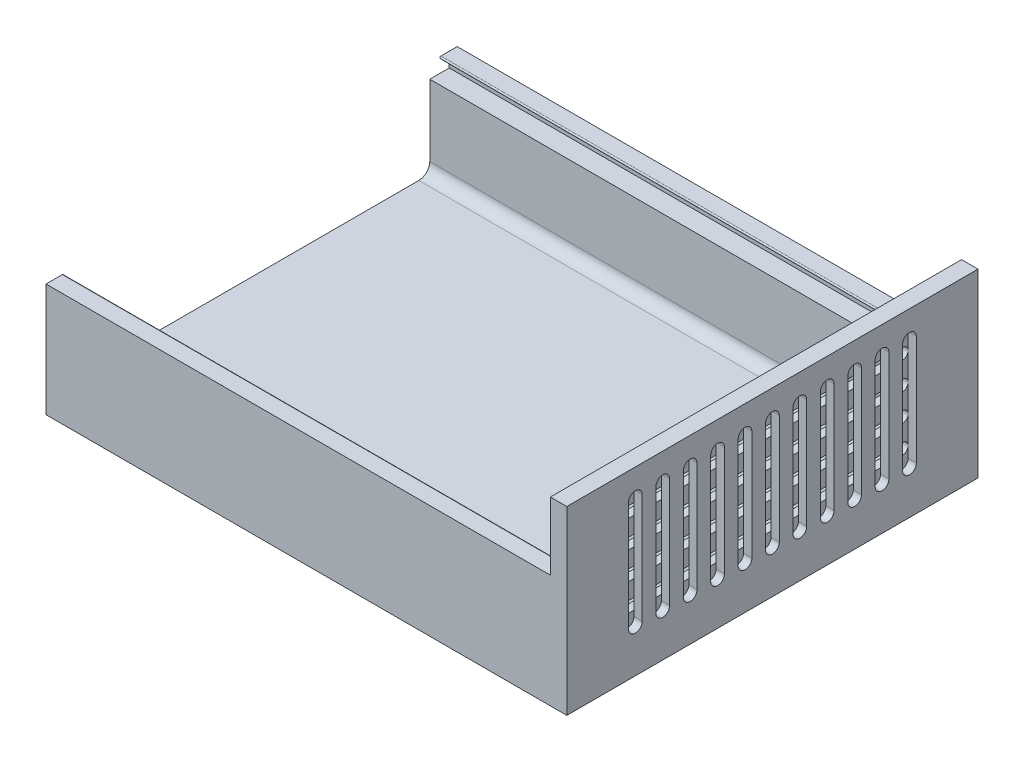
from build123d import *

# Parameters (mm, degrees)
SKETCH1_W           = 95
SKETCH1_H           = 75
BOSS_EXTRUDE1_DEPTH = 3
SKETCH2_W           = 95
SKETCH2_H           = 5
BOSS_EXTRUDE2_DEPTH = 15
SKETCH3_W           = 3
SKETCH3_H           = 75
BOSS_EXTRUDE3_DEPTH = 30
CUT_EXTRUDE1_DEPTH  = 1.5
CUT_EXTRUDE2_DEPTH  = 1.5
BOSS_EXTRUDE4_DEPTH = 95
FILLET1_R           = 0.2
FILLET2_R           = 2


with BuildPart() as part:
    # Sketch1 → Boss-Extrude1 (new body)
    with BuildSketch(Plane(origin=(0, 0, 0), x_dir=(1, 0, 0), z_dir=(0, 1, 0))):
        Rectangle(SKETCH1_W, SKETCH1_H)
    extrude(amount=BOSS_EXTRUDE1_DEPTH)

    # Sketch2 → Boss-Extrude2 (add)
    with BuildSketch(Plane(origin=(0, 3, 0), x_dir=(1, 0, 0), z_dir=(0, 1, 0))):
        with Locations((0, 35)):
            Rectangle(SKETCH2_W, SKETCH2_H)
        with Locations((0, -35)):
            Rectangle(SKETCH2_W, SKETCH2_H)
    extrude(amount=BOSS_EXTRUDE2_DEPTH)

    # Sketch3 → Boss-Extrude3 (add)
    with BuildSketch(Plane(origin=(0, 3, 0), x_dir=(1, 0, 0), z_dir=(0, 1, 0))):
        with Locations((46, 0)):
            Rectangle(SKETCH3_W, SKETCH3_H)
    extrude(amount=BOSS_EXTRUDE3_DEPTH)

    # Sketch4 → Cut-Extrude1 (cut)
    with BuildSketch(Plane(origin=(47.5, 0, 0), x_dir=(0, 0, -1), z_dir=(1, 0, 0))):
        with BuildLine():
            Line((26.25, 8), (26.25, 28))
            ThreePointArc((26.25, 28), (25, 29.25), (23.75, 28))
            Line((23.75, 28), (23.75, 8))
            ThreePointArc((23.75, 8), (25, 6.75), (26.25, 8))
        make_face()
        with BuildLine():
            Line((21.25, 8), (21.25, 28))
            ThreePointArc((21.25, 28), (20, 29.25), (18.75, 28))
            Line((18.75, 28), (18.75, 8))
            ThreePointArc((18.75, 8), (20, 6.75), (21.25, 8))
        make_face()
        with BuildLine():
            Line((16.25, 8), (16.25, 28))
            ThreePointArc((16.25, 28), (15, 29.25), (13.75, 28))
            Line((13.75, 28), (13.75, 8))
            ThreePointArc((13.75, 8), (15, 6.75), (16.25, 8))
        make_face()
        with BuildLine():
            Line((11.25, 8), (11.25, 28))
            ThreePointArc((11.25, 28), (10, 29.25), (8.75, 28))
            Line((8.75, 28), (8.75, 8))
            ThreePointArc((8.75, 8), (10, 6.75), (11.25, 8))
        make_face()
        with BuildLine():
            Line((6.25, 8), (6.25, 28))
            ThreePointArc((6.25, 28), (5, 29.25), (3.75, 28))
            Line((3.75, 28), (3.75, 8))
            ThreePointArc((3.75, 8), (5, 6.75), (6.25, 8))
        make_face()
        with BuildLine():
            Line((1.25, 8), (1.25, 28))
            ThreePointArc((1.25, 28), (0, 29.25), (-1.25, 28))
            Line((-1.25, 28), (-1.25, 8))
            ThreePointArc((-1.25, 8), (0, 6.75), (1.25, 8))
        make_face()
        with BuildLine():
            Line((-3.75, 8), (-3.75, 28))
            ThreePointArc((-3.75, 28), (-5, 29.25), (-6.25, 28))
            Line((-6.25, 28), (-6.25, 8))
            ThreePointArc((-6.25, 8), (-5, 6.75), (-3.75, 8))
        make_face()
        with BuildLine():
            Line((-8.75, 8), (-8.75, 28))
            ThreePointArc((-8.75, 28), (-10, 29.25), (-11.25, 28))
            Line((-11.25, 28), (-11.25, 8))
            ThreePointArc((-11.25, 8), (-10, 6.75), (-8.75, 8))
        make_face()
        with BuildLine():
            Line((-13.75, 8), (-13.75, 28))
            ThreePointArc((-13.75, 28), (-15, 29.25), (-16.25, 28))
            Line((-16.25, 28), (-16.25, 8))
            ThreePointArc((-16.25, 8), (-15, 6.75), (-13.75, 8))
        make_face()
        with BuildLine():
            Line((-18.75, 8), (-18.75, 28))
            ThreePointArc((-18.75, 28), (-20, 29.25), (-21.25, 28))
            Line((-21.25, 28), (-21.25, 8))
            ThreePointArc((-21.25, 8), (-20, 6.75), (-18.75, 8))
        make_face()
        with BuildLine():
            Line((-23.75, 8), (-23.75, 28))
            ThreePointArc((-23.75, 28), (-25, 29.25), (-26.25, 28))
            Line((-26.25, 28), (-26.25, 8))
            ThreePointArc((-26.25, 8), (-25, 6.75), (-23.75, 8))
        make_face()
    extrude(amount=-CUT_EXTRUDE1_DEPTH, mode=Mode.SUBTRACT)

    # Sketch5 → Cut-Extrude2 (cut)
    with BuildSketch(Plane.ZY.offset(-44.5)):
        with BuildLine():
            Line((-25.25, 24), (25.25, 24))
            ThreePointArc((25.25, 24), (26.25, 25), (25.25, 26))
            Line((25.25, 26), (-25.25, 26))
            ThreePointArc((-25.25, 26), (-26.25, 25), (-25.25, 24))
        make_face()
        with BuildLine():
            Line((-25.25, 19), (25.25, 19))
            ThreePointArc((25.25, 19), (26.25, 20), (25.25, 21))
            Line((25.25, 21), (-25.25, 21))
            ThreePointArc((-25.25, 21), (-26.25, 20), (-25.25, 19))
        make_face()
        with BuildLine():
            Line((-25.25, 14), (25.25, 14))
            ThreePointArc((25.25, 14), (26.25, 15), (25.25, 16))
            Line((25.25, 16), (-25.25, 16))
            ThreePointArc((-25.25, 16), (-26.25, 15), (-25.25, 14))
        make_face()
        with BuildLine():
            Line((-25.25, 9), (25.25, 9))
            ThreePointArc((25.25, 9), (26.25, 10), (25.25, 11))
            Line((25.25, 11), (-25.25, 11))
            ThreePointArc((-25.25, 11), (-26.25, 10), (-25.25, 9))
        make_face()
    extrude(amount=-CUT_EXTRUDE2_DEPTH, mode=Mode.SUBTRACT)

    # Sketch6 → Boss-Extrude4 (add)
    with BuildSketch(Plane.ZY.offset(47.5)):
        Polygon((37.5, 18), (37.5, 20.65), (34.05, 20.65), (36.05, 18.65), (36.05, 18), align=None)
        Polygon((-36.05, 18), (-37.5, 18), (-37.5, 20.65), (-34.05, 20.65), (-36.05, 18.65), align=None)
    extrude(amount=-BOSS_EXTRUDE4_DEPTH)

    # Fillet1
    fillet1_edges = [part.edges().sort_by_distance(p)[0] for p in [
        (-1.5, 20.65, 34.05),
        (-1.5, 20.65, -34.05),
    ]]
    fillet(fillet1_edges, radius=FILLET1_R)

    # Fillet2
    fillet2_edges = [part.edges().sort_by_distance(p)[0] for p in [
        (-1.5, 3, -32.5),
        (-1.5, 3, 32.5),
        (44.5, 3, 0),
    ]]
    fillet(fillet2_edges, radius=FILLET2_R)


solid = part.part
